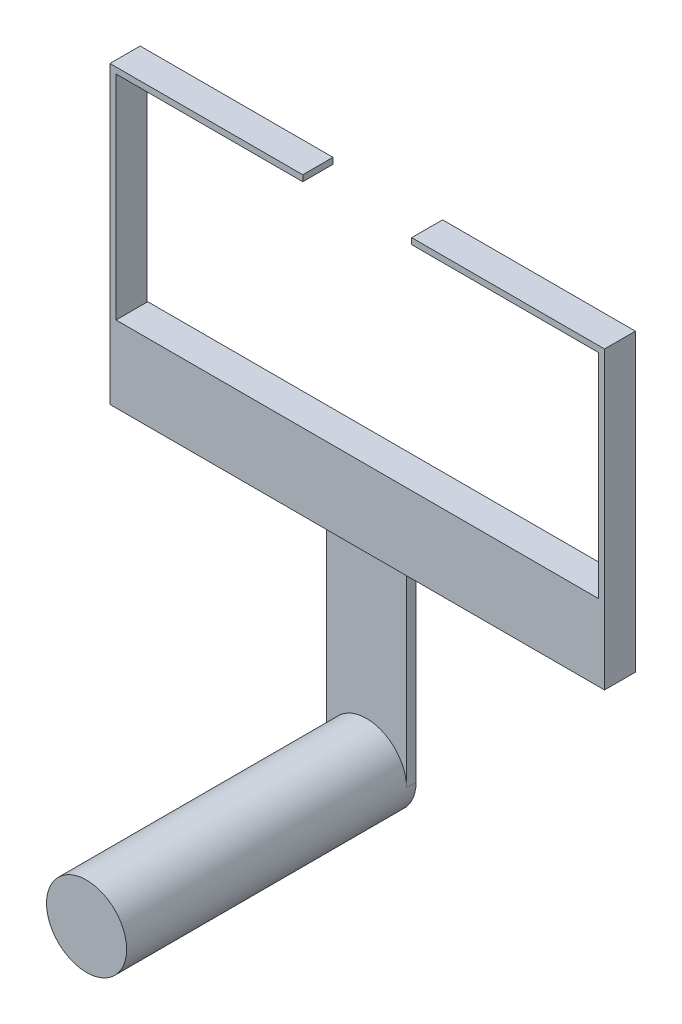
from build123d import *

# Parameters (mm, degrees)
SKETCH1_R       = 5.270407467
FEATURE_A_DEPTH = 38.1
SKETCH2_W       = 10.540814934
SKETCH2_H       = 25.4
FEATURE_B_DEPTH = 1.246819584
SKETCH5_W       = 63.5
SKETCH5_H       = 4.173585558
FEATURE_C_DEPTH = 10.027755954
SKETCH6_W       = 0.800228097
SKETCH6_H       = 38.0746
FEATURE_D_DEPTH = 4.064
SKETCH7_W       = 25.37968
SKETCH7_H       = 3.975694803
SKETCH7_H_2     = 4.064
FEATURE_E_DEPTH = 0.800228097


with BuildPart() as part:
    # Sketch1 → Feature A (new body)
    with BuildSketch(Plane.XY):
        Circle(SKETCH1_R)
    extrude(amount=-FEATURE_A_DEPTH)

    # Sketch2 → Feature B (add)
    with BuildSketch(Plane(origin=(0, 0, -38.1), x_dir=(-1, 0, 0), z_dir=(0, 0, -1))):
        with Locations((0, 12.7)):
            Rectangle(SKETCH2_W, SKETCH2_H)
    extrude(amount=-FEATURE_B_DEPTH)

    # Sketch5 → Feature C (add)
    with BuildSketch(Plane(origin=(0, 25.4, 0), x_dir=(1, 0, 0), z_dir=(0, 1, 0))):
        with Locations((0, 37.71392)):
            Rectangle(SKETCH5_W, SKETCH5_H)
    extrude(amount=FEATURE_C_DEPTH)

    # Sketch6 → Feature D (add)
    with BuildSketch(Plane.XY.offset(-35.627127221)):
        with Locations((-32.150114049, 44.4373)):
            Rectangle(SKETCH6_W, SKETCH6_H)
        with Locations((32.150114049, 44.4373)):
            Rectangle(SKETCH6_W, SKETCH6_H)
    extrude(amount=-FEATURE_D_DEPTH)

    # Sketch7 → Feature E (add)
    with BuildSketch(Plane(origin=(0, 63.4746, 0), x_dir=(1, 0, 0), z_dir=(0, 1, 0))):
        with Locations((-19.860388097, 37.614974623)):
            Rectangle(SKETCH7_W, SKETCH7_H)
        with Locations((19.860388097, 37.659127221)):
            Rectangle(SKETCH7_W, SKETCH7_H_2)
    extrude(amount=FEATURE_E_DEPTH)


solid = part.part
